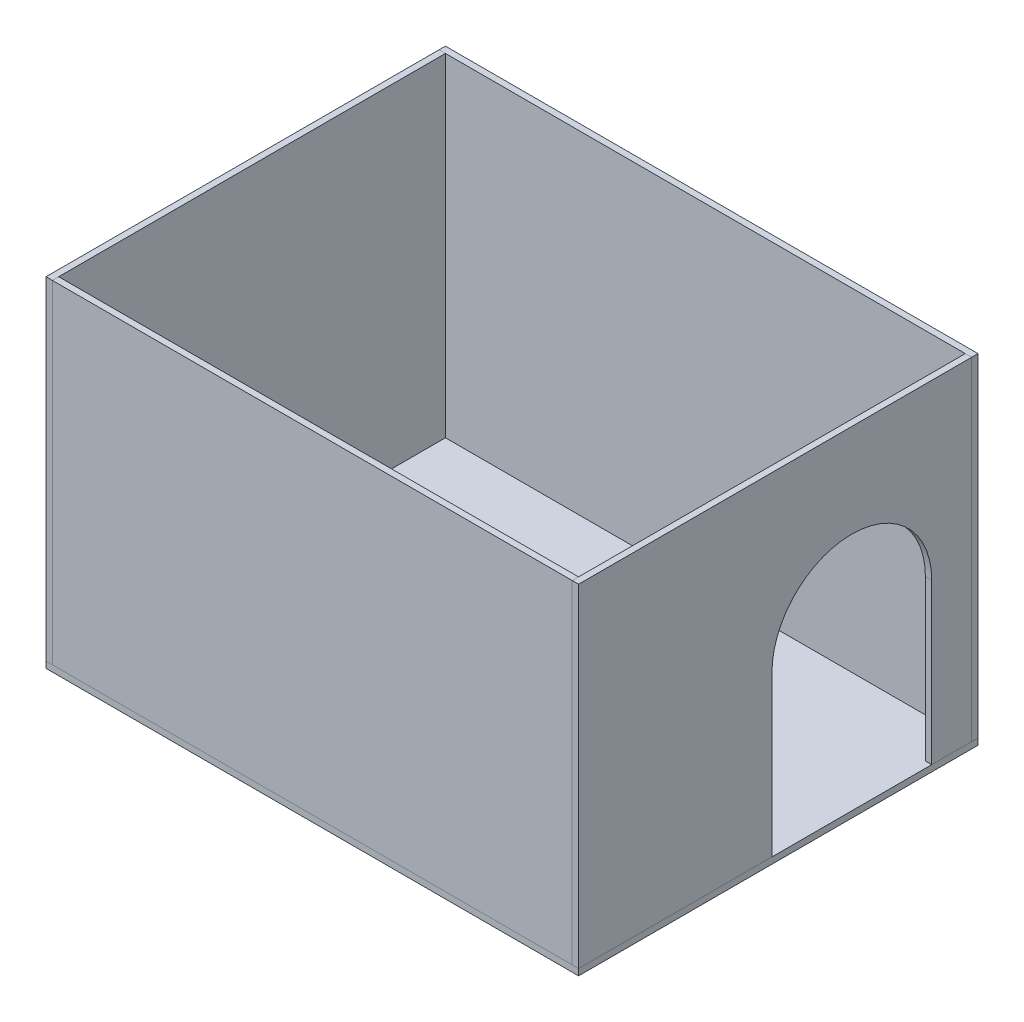
from build123d import *

# Parameters (mm, degrees)
BASE_W              = 400
BASE_H              = 300
BASE_EXTRUDE_DEPTH  = 4.76
BOSS_EXTRUDE2_START = 4.76
BOSS_EXTRUDE2_DEPTH = 250
BOSS_EXTRUDE3_START = 4.76
SKETCH2_3_W         = 400
SKETCH2_3_H         = 4.76
BOSS_EXTRUDE3_DEPTH = 250
BOSS_EXTRUDE4_START = 4.76
SKETCH2_4_W         = 4.76
SKETCH2_4_H         = 295.24
BOSS_EXTRUDE4_DEPTH = 250
BOSS_EXTRUDE5_START = 4.76
SKETCH2_5_W         = 390.48
SKETCH2_5_H         = 4.76
BOSS_EXTRUDE5_DEPTH = 250
CUT_EXTRUDE1_DEPTH  = 5


with BuildPart() as part:
    # base → base-extrude (new body)
    with BuildSketch(Plane(origin=(0, 0, 0), x_dir=(1, 0, 0), z_dir=(0, 1, 0))):
        with Locations((200, 150)):
            Rectangle(BASE_W, BASE_H)
    extrude(amount=BASE_EXTRUDE_DEPTH)


with BuildPart() as body_2:
    # Sketch2 → Boss-Extrude2 (new body)
    with BuildSketch(Plane(origin=(0, 0, 0), x_dir=(1, 0, 0), z_dir=(0, 1, 0)).offset(BOSS_EXTRUDE2_START)):
        Polygon((4.76, 295.24), (0, 295.24), (0, 0), (4.76, 0), (4.76, 4.76), align=None)
    extrude(amount=BOSS_EXTRUDE2_DEPTH)


with BuildPart() as body_3:
    # Sketch2<3> → Boss-Extrude3 (new body)
    with BuildSketch(Plane(origin=(0, 0, 0), x_dir=(1, 0, 0), z_dir=(0, 1, 0)).offset(BOSS_EXTRUDE3_START)):
        with Locations((200, 297.62)):
            Rectangle(SKETCH2_3_W, SKETCH2_3_H)
    extrude(amount=BOSS_EXTRUDE3_DEPTH)


with BuildPart() as body_4:
    # Sketch2<4> → Boss-Extrude4 (new body)
    with BuildSketch(Plane(origin=(0, 0, 0), x_dir=(1, 0, 0), z_dir=(0, 1, 0)).offset(BOSS_EXTRUDE4_START)):
        with Locations((397.62, 147.62)):
            Rectangle(SKETCH2_4_W, SKETCH2_4_H)
    extrude(amount=BOSS_EXTRUDE4_DEPTH)

    # Sketch3 → Cut-Extrude1 (cut)
    with BuildSketch(Plane(origin=(400, 0, 0), x_dir=(0, 0, -1), z_dir=(1, 0, 0))):
        with BuildLine():
            Line((145.24, 4.76), (145.24, 124.76))
            ThreePointArc((145.24, 124.76), (205.24, 184.76), (265.24, 124.76))
            Line((265.24, 124.76), (265.24, 4.76))
            Line((265.24, 4.76), (145.24, 4.76))
        make_face()
    extrude(amount=-CUT_EXTRUDE1_DEPTH, mode=Mode.SUBTRACT)


with BuildPart() as body_5:
    # Sketch2<5> → Boss-Extrude5 (new body)
    with BuildSketch(Plane(origin=(0, 0, 0), x_dir=(1, 0, 0), z_dir=(0, 1, 0)).offset(BOSS_EXTRUDE5_START)):
        with Locations((200, 2.38)):
            Rectangle(SKETCH2_5_W, SKETCH2_5_H)
    extrude(amount=BOSS_EXTRUDE5_DEPTH)


solid = Compound([part.part, body_2.part, body_3.part, body_4.part, body_5.part])
